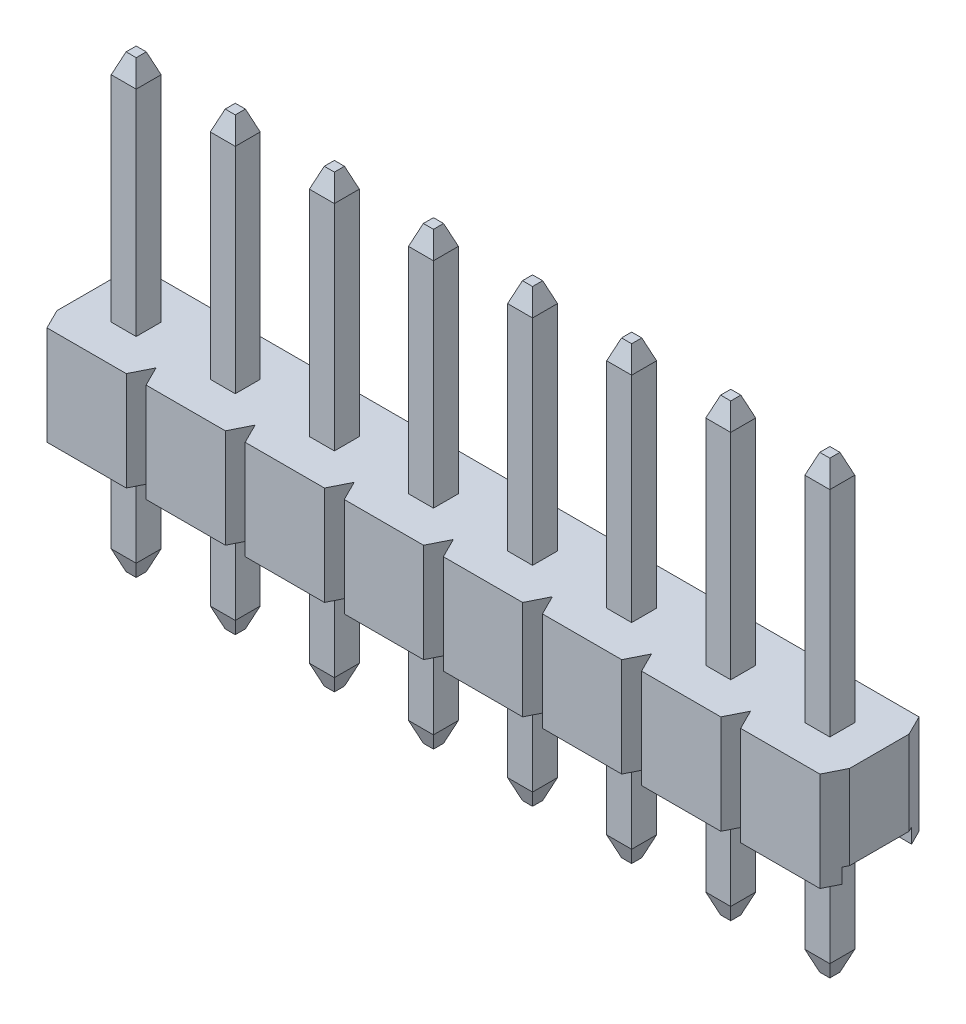
from build123d import *
from OCP.BRepFilletAPI import BRepFilletAPI_MakeChamfer

# Parameters (mm, degrees)
SKETCH1_W                     = 2.54
SKETCH1_H                     = 2.54
MAIN_BODY_DEPTH               = 2.54
SKETCH3_W                     = 1.778
SKETCH3_H                     = 0.381
CUT_EXTRUDE1_DEPTH            = 5.399409051
CUT_EXTRUDE2_DEPTH            = 5.399409051
BODY_PATTERN_COUNT            = 8
BODY_PATTERN_PITCH            = 2.54
PIN_START                     = -5.54
SKETCH2_W                     = 0.64
SKETCH2_H                     = 0.64
PIN_DEPTH                     = 11.54
CHAMFER1_SIZE                 = 0.508
CHAMFER1_SIZE2                = 0.1905
CHAMFER2_SIZE                 = 0.1905
CHAMFER2_SIZE2                = 0.508
PIN_PATTERN_COUNT             = 8
PIN_PATTERN_PITCH             = 2.54
CHAMFER1_OF_PIN_PATTERN_SIZE  = 0.508
CHAMFER1_OF_PIN_PATTERN_SIZE2 = 0.1905
CHAMFER2_OF_PIN_PATTERN_SIZE2 = 0.1905
CHAMFER2_OF_PIN_PATTERN_SIZE  = 0.508


with BuildPart() as part:
    # Sketch1 → Main Body (new body)
    with BuildSketch(Plane(origin=(0, 0, 0), x_dir=(1, 0, 0), z_dir=(0, 1, 0))):
        with Locations((1.27, 1.27)):
            Rectangle(SKETCH1_W, SKETCH1_H)
    main_body = extrude(amount=MAIN_BODY_DEPTH)

    # Sketch3 → Cut-Extrude1 (cut, through all)
    with BuildSketch(Plane.ZY):
        with Locations((-1.27, 0.1905)):
            Rectangle(SKETCH3_W, SKETCH3_H)
    cut_extrude1 = extrude(amount=-CUT_EXTRUDE1_DEPTH, mode=Mode.SUBTRACT)

    # Sketch4 → Cut-Extrude2 (cut, through all)
    with BuildSketch(Plane(origin=(0, 2.54, 0), x_dir=(1, 0, 0), z_dir=(0, 1, 0))):
        Polygon((0.254, 2.54), (0, 2.54), (0, 2.032), align=None)
        Polygon((2.54, 2.54), (2.286, 2.54), (2.54, 2.032), align=None)
        Polygon((0.254, 0), (0, 0.508), (0, 0), align=None)
        Polygon((2.54, 0), (2.286, 0), (2.54, 0.508), align=None)
    cut_extrude2 = extrude(amount=-CUT_EXTRUDE2_DEPTH, mode=Mode.SUBTRACT)

    # Body Pattern: Main Body, Cut-Extrude1, Cut-Extrude2 ×8
    with Locations(*[(-i * BODY_PATTERN_PITCH, 0, 0) for i in range(1, BODY_PATTERN_COUNT)]):
        add(main_body)
        add(cut_extrude1, mode=Mode.SUBTRACT)
        add(cut_extrude2, mode=Mode.SUBTRACT)

    # Sketch2 → Pin (add)
    with BuildSketch(Plane(origin=(0, 2.54, 0), x_dir=(1, 0, 0), z_dir=(0, 1, 0)).offset(PIN_START)):
        with Locations((1.27, 1.27)):
            Rectangle(SKETCH2_W, SKETCH2_H)
    pin = extrude(amount=PIN_DEPTH)

    # Chamfer1: one chamfer whose edges measure the first distance from different faces: ONE call of the kernel's chamfer builder (chamfer() names one face for all edges)
    chamfer1_edges_1 = [part.edges().sort_by_distance(p)[0] for p in [
        (0.95, 8.54, -1.27),
    ]]
    chamfer1_side_1 = [part.faces().sort_by_distance(p)[0] for p in [
        (0.95, 5.54, -1.27),
    ]]
    chamfer1_edges_2 = [part.edges().sort_by_distance(p)[0] for p in [
        (1.27, 8.54, -0.95),
    ]]
    chamfer1_side_2 = [part.faces().sort_by_distance(p)[0] for p in [
        (1.27, 5.54, -0.95),
    ]]
    chamfer1_edges_3 = [part.edges().sort_by_distance(p)[0] for p in [
        (1.59, 8.54, -1.27),
    ]]
    chamfer1_side_3 = [part.faces().sort_by_distance(p)[0] for p in [
        (1.59, 5.54, -1.27),
    ]]
    chamfer1_edges_4 = [part.edges().sort_by_distance(p)[0] for p in [
        (1.27, 8.54, -1.59),
    ]]
    chamfer1_side_4 = [part.faces().sort_by_distance(p)[0] for p in [
        (1.27, 5.54, -1.59),
    ]]
    chamfer1 = BRepFilletAPI_MakeChamfer(part.part.solid().wrapped)
    for e in chamfer1_edges_1:
        chamfer1.Add(CHAMFER1_SIZE, CHAMFER1_SIZE2, e.wrapped, chamfer1_side_1[0].wrapped)  # the first distance lies on this face
    for e in chamfer1_edges_2:
        chamfer1.Add(CHAMFER1_SIZE, CHAMFER1_SIZE2, e.wrapped, chamfer1_side_2[0].wrapped)  # the first distance lies on this face
    for e in chamfer1_edges_3:
        chamfer1.Add(CHAMFER1_SIZE, CHAMFER1_SIZE2, e.wrapped, chamfer1_side_3[0].wrapped)  # the first distance lies on this face
    for e in chamfer1_edges_4:
        chamfer1.Add(CHAMFER1_SIZE, CHAMFER1_SIZE2, e.wrapped, chamfer1_side_4[0].wrapped)  # the first distance lies on this face
    add(Compound.cast(chamfer1.Shape()), mode=Mode.REPLACE)

    # Chamfer2
    chamfer2_edges = [part.edges().sort_by_distance(p)[0] for p in [
        (1.27, -3, -0.95),
        (1.59, -3, -1.27),
        (1.27, -3, -1.59),
        (0.95, -3, -1.27),
    ]]
    chamfer2_side = [part.faces().sort_by_distance(p)[0] for p in [
        (1.27, -3, -1.27),
    ]]
    chamfer(chamfer2_edges, length=CHAMFER2_SIZE, length2=CHAMFER2_SIZE2, reference=chamfer2_side[0])

    # Pin Pattern: Pin ×8
    with Locations(*[(-i * PIN_PATTERN_PITCH, 0, 0) for i in range(1, PIN_PATTERN_COUNT)]):
        add(pin)

    # Chamfer1 of Pin Pattern: one chamfer whose edges measure the first distance from different faces: ONE call of the kernel's chamfer builder (chamfer() names one face for all edges)
    chamfer1_of_pin_pattern_edges_1 = [part.edges().sort_by_distance(p)[0] for p in [
        (-1.59, 8.54, -1.27),
    ]]
    chamfer1_of_pin_pattern_side_1 = [part.faces().sort_by_distance(p)[0] for p in [
        (-1.59, 5.54, -1.27),
    ]]
    chamfer1_of_pin_pattern_edges_2 = [part.edges().sort_by_distance(p)[0] for p in [
        (-1.27, 8.54, -0.95),
    ]]
    chamfer1_of_pin_pattern_side_2 = [part.faces().sort_by_distance(p)[0] for p in [
        (-1.27, 5.54, -0.95),
    ]]
    chamfer1_of_pin_pattern_edges_3 = [part.edges().sort_by_distance(p)[0] for p in [
        (-0.95, 8.54, -1.27),
    ]]
    chamfer1_of_pin_pattern_side_3 = [part.faces().sort_by_distance(p)[0] for p in [
        (-0.95, 5.54, -1.27),
    ]]
    chamfer1_of_pin_pattern_edges_4 = [part.edges().sort_by_distance(p)[0] for p in [
        (-1.27, 8.54, -1.59),
    ]]
    chamfer1_of_pin_pattern_side_4 = [part.faces().sort_by_distance(p)[0] for p in [
        (-1.27, 5.54, -1.59),
    ]]
    chamfer1_of_pin_pattern_edges_5 = [part.edges().sort_by_distance(p)[0] for p in [
        (-4.13, 8.54, -1.27),
    ]]
    chamfer1_of_pin_pattern_side_5 = [part.faces().sort_by_distance(p)[0] for p in [
        (-4.13, 5.54, -1.27),
    ]]
    chamfer1_of_pin_pattern_edges_6 = [part.edges().sort_by_distance(p)[0] for p in [
        (-3.81, 8.54, -0.95),
    ]]
    chamfer1_of_pin_pattern_side_6 = [part.faces().sort_by_distance(p)[0] for p in [
        (-3.81, 5.54, -0.95),
    ]]
    chamfer1_of_pin_pattern_edges_7 = [part.edges().sort_by_distance(p)[0] for p in [
        (-3.49, 8.54, -1.27),
    ]]
    chamfer1_of_pin_pattern_side_7 = [part.faces().sort_by_distance(p)[0] for p in [
        (-3.49, 5.54, -1.27),
    ]]
    chamfer1_of_pin_pattern_edges_8 = [part.edges().sort_by_distance(p)[0] for p in [
        (-3.81, 8.54, -1.59),
    ]]
    chamfer1_of_pin_pattern_side_8 = [part.faces().sort_by_distance(p)[0] for p in [
        (-3.81, 5.54, -1.59),
    ]]
    chamfer1_of_pin_pattern_edges_9 = [part.edges().sort_by_distance(p)[0] for p in [
        (-6.67, 8.54, -1.27),
    ]]
    chamfer1_of_pin_pattern_side_9 = [part.faces().sort_by_distance(p)[0] for p in [
        (-6.67, 5.54, -1.27),
    ]]
    chamfer1_of_pin_pattern_edges_10 = [part.edges().sort_by_distance(p)[0] for p in [
        (-6.35, 8.54, -0.95),
    ]]
    chamfer1_of_pin_pattern_side_10 = [part.faces().sort_by_distance(p)[0] for p in [
        (-6.35, 5.54, -0.95),
    ]]
    chamfer1_of_pin_pattern_edges_11 = [part.edges().sort_by_distance(p)[0] for p in [
        (-6.03, 8.54, -1.27),
    ]]
    chamfer1_of_pin_pattern_side_11 = [part.faces().sort_by_distance(p)[0] for p in [
        (-6.03, 5.54, -1.27),
    ]]
    chamfer1_of_pin_pattern_edges_12 = [part.edges().sort_by_distance(p)[0] for p in [
        (-6.35, 8.54, -1.59),
    ]]
    chamfer1_of_pin_pattern_side_12 = [part.faces().sort_by_distance(p)[0] for p in [
        (-6.35, 5.54, -1.59),
    ]]
    chamfer1_of_pin_pattern_edges_13 = [part.edges().sort_by_distance(p)[0] for p in [
        (-9.21, 8.54, -1.27),
    ]]
    chamfer1_of_pin_pattern_side_13 = [part.faces().sort_by_distance(p)[0] for p in [
        (-9.21, 5.54, -1.27),
    ]]
    chamfer1_of_pin_pattern_edges_14 = [part.edges().sort_by_distance(p)[0] for p in [
        (-8.89, 8.54, -0.95),
    ]]
    chamfer1_of_pin_pattern_side_14 = [part.faces().sort_by_distance(p)[0] for p in [
        (-8.89, 5.54, -0.95),
    ]]
    chamfer1_of_pin_pattern_edges_15 = [part.edges().sort_by_distance(p)[0] for p in [
        (-8.57, 8.54, -1.27),
    ]]
    chamfer1_of_pin_pattern_side_15 = [part.faces().sort_by_distance(p)[0] for p in [
        (-8.57, 5.54, -1.27),
    ]]
    chamfer1_of_pin_pattern_edges_16 = [part.edges().sort_by_distance(p)[0] for p in [
        (-8.89, 8.54, -1.59),
    ]]
    chamfer1_of_pin_pattern_side_16 = [part.faces().sort_by_distance(p)[0] for p in [
        (-8.89, 5.54, -1.59),
    ]]
    chamfer1_of_pin_pattern_edges_17 = [part.edges().sort_by_distance(p)[0] for p in [
        (-11.75, 8.54, -1.27),
    ]]
    chamfer1_of_pin_pattern_side_17 = [part.faces().sort_by_distance(p)[0] for p in [
        (-11.75, 5.54, -1.27),
    ]]
    chamfer1_of_pin_pattern_edges_18 = [part.edges().sort_by_distance(p)[0] for p in [
        (-11.43, 8.54, -0.95),
    ]]
    chamfer1_of_pin_pattern_side_18 = [part.faces().sort_by_distance(p)[0] for p in [
        (-11.43, 5.54, -0.95),
    ]]
    chamfer1_of_pin_pattern_edges_19 = [part.edges().sort_by_distance(p)[0] for p in [
        (-11.11, 8.54, -1.27),
    ]]
    chamfer1_of_pin_pattern_side_19 = [part.faces().sort_by_distance(p)[0] for p in [
        (-11.11, 5.54, -1.27),
    ]]
    chamfer1_of_pin_pattern_edges_20 = [part.edges().sort_by_distance(p)[0] for p in [
        (-11.43, 8.54, -1.59),
    ]]
    chamfer1_of_pin_pattern_side_20 = [part.faces().sort_by_distance(p)[0] for p in [
        (-11.43, 5.54, -1.59),
    ]]
    chamfer1_of_pin_pattern_edges_21 = [part.edges().sort_by_distance(p)[0] for p in [
        (-14.29, 8.54, -1.27),
    ]]
    chamfer1_of_pin_pattern_side_21 = [part.faces().sort_by_distance(p)[0] for p in [
        (-14.29, 5.54, -1.27),
    ]]
    chamfer1_of_pin_pattern_edges_22 = [part.edges().sort_by_distance(p)[0] for p in [
        (-13.97, 8.54, -0.95),
    ]]
    chamfer1_of_pin_pattern_side_22 = [part.faces().sort_by_distance(p)[0] for p in [
        (-13.97, 5.54, -0.95),
    ]]
    chamfer1_of_pin_pattern_edges_23 = [part.edges().sort_by_distance(p)[0] for p in [
        (-13.65, 8.54, -1.27),
    ]]
    chamfer1_of_pin_pattern_side_23 = [part.faces().sort_by_distance(p)[0] for p in [
        (-13.65, 5.54, -1.27),
    ]]
    chamfer1_of_pin_pattern_edges_24 = [part.edges().sort_by_distance(p)[0] for p in [
        (-13.97, 8.54, -1.59),
    ]]
    chamfer1_of_pin_pattern_side_24 = [part.faces().sort_by_distance(p)[0] for p in [
        (-13.97, 5.54, -1.59),
    ]]
    chamfer1_of_pin_pattern_edges_25 = [part.edges().sort_by_distance(p)[0] for p in [
        (-16.83, 8.54, -1.27),
    ]]
    chamfer1_of_pin_pattern_side_25 = [part.faces().sort_by_distance(p)[0] for p in [
        (-16.83, 5.54, -1.27),
    ]]
    chamfer1_of_pin_pattern_edges_26 = [part.edges().sort_by_distance(p)[0] for p in [
        (-16.51, 8.54, -0.95),
    ]]
    chamfer1_of_pin_pattern_side_26 = [part.faces().sort_by_distance(p)[0] for p in [
        (-16.51, 5.54, -0.95),
    ]]
    chamfer1_of_pin_pattern_edges_27 = [part.edges().sort_by_distance(p)[0] for p in [
        (-16.19, 8.54, -1.27),
    ]]
    chamfer1_of_pin_pattern_side_27 = [part.faces().sort_by_distance(p)[0] for p in [
        (-16.19, 5.54, -1.27),
    ]]
    chamfer1_of_pin_pattern_edges_28 = [part.edges().sort_by_distance(p)[0] for p in [
        (-16.51, 8.54, -1.59),
    ]]
    chamfer1_of_pin_pattern_side_28 = [part.faces().sort_by_distance(p)[0] for p in [
        (-16.51, 5.54, -1.59),
    ]]
    chamfer1_of_pin_pattern = BRepFilletAPI_MakeChamfer(part.part.solid().wrapped)
    for e in chamfer1_of_pin_pattern_edges_1:
        chamfer1_of_pin_pattern.Add(CHAMFER1_OF_PIN_PATTERN_SIZE, CHAMFER1_OF_PIN_PATTERN_SIZE2, e.wrapped, chamfer1_of_pin_pattern_side_1[0].wrapped)  # the first distance lies on this face
    for e in chamfer1_of_pin_pattern_edges_2:
        chamfer1_of_pin_pattern.Add(CHAMFER1_OF_PIN_PATTERN_SIZE, CHAMFER1_OF_PIN_PATTERN_SIZE2, e.wrapped, chamfer1_of_pin_pattern_side_2[0].wrapped)  # the first distance lies on this face
    for e in chamfer1_of_pin_pattern_edges_3:
        chamfer1_of_pin_pattern.Add(CHAMFER1_OF_PIN_PATTERN_SIZE, CHAMFER1_OF_PIN_PATTERN_SIZE2, e.wrapped, chamfer1_of_pin_pattern_side_3[0].wrapped)  # the first distance lies on this face
    for e in chamfer1_of_pin_pattern_edges_4:
        chamfer1_of_pin_pattern.Add(CHAMFER1_OF_PIN_PATTERN_SIZE, CHAMFER1_OF_PIN_PATTERN_SIZE2, e.wrapped, chamfer1_of_pin_pattern_side_4[0].wrapped)  # the first distance lies on this face
    for e in chamfer1_of_pin_pattern_edges_5:
        chamfer1_of_pin_pattern.Add(CHAMFER1_OF_PIN_PATTERN_SIZE, CHAMFER1_OF_PIN_PATTERN_SIZE2, e.wrapped, chamfer1_of_pin_pattern_side_5[0].wrapped)  # the first distance lies on this face
    for e in chamfer1_of_pin_pattern_edges_6:
        chamfer1_of_pin_pattern.Add(CHAMFER1_OF_PIN_PATTERN_SIZE, CHAMFER1_OF_PIN_PATTERN_SIZE2, e.wrapped, chamfer1_of_pin_pattern_side_6[0].wrapped)  # the first distance lies on this face
    for e in chamfer1_of_pin_pattern_edges_7:
        chamfer1_of_pin_pattern.Add(CHAMFER1_OF_PIN_PATTERN_SIZE, CHAMFER1_OF_PIN_PATTERN_SIZE2, e.wrapped, chamfer1_of_pin_pattern_side_7[0].wrapped)  # the first distance lies on this face
    for e in chamfer1_of_pin_pattern_edges_8:
        chamfer1_of_pin_pattern.Add(CHAMFER1_OF_PIN_PATTERN_SIZE, CHAMFER1_OF_PIN_PATTERN_SIZE2, e.wrapped, chamfer1_of_pin_pattern_side_8[0].wrapped)  # the first distance lies on this face
    for e in chamfer1_of_pin_pattern_edges_9:
        chamfer1_of_pin_pattern.Add(CHAMFER1_OF_PIN_PATTERN_SIZE, CHAMFER1_OF_PIN_PATTERN_SIZE2, e.wrapped, chamfer1_of_pin_pattern_side_9[0].wrapped)  # the first distance lies on this face
    for e in chamfer1_of_pin_pattern_edges_10:
        chamfer1_of_pin_pattern.Add(CHAMFER1_OF_PIN_PATTERN_SIZE, CHAMFER1_OF_PIN_PATTERN_SIZE2, e.wrapped, chamfer1_of_pin_pattern_side_10[0].wrapped)  # the first distance lies on this face
    for e in chamfer1_of_pin_pattern_edges_11:
        chamfer1_of_pin_pattern.Add(CHAMFER1_OF_PIN_PATTERN_SIZE, CHAMFER1_OF_PIN_PATTERN_SIZE2, e.wrapped, chamfer1_of_pin_pattern_side_11[0].wrapped)  # the first distance lies on this face
    for e in chamfer1_of_pin_pattern_edges_12:
        chamfer1_of_pin_pattern.Add(CHAMFER1_OF_PIN_PATTERN_SIZE, CHAMFER1_OF_PIN_PATTERN_SIZE2, e.wrapped, chamfer1_of_pin_pattern_side_12[0].wrapped)  # the first distance lies on this face
    for e in chamfer1_of_pin_pattern_edges_13:
        chamfer1_of_pin_pattern.Add(CHAMFER1_OF_PIN_PATTERN_SIZE, CHAMFER1_OF_PIN_PATTERN_SIZE2, e.wrapped, chamfer1_of_pin_pattern_side_13[0].wrapped)  # the first distance lies on this face
    for e in chamfer1_of_pin_pattern_edges_14:
        chamfer1_of_pin_pattern.Add(CHAMFER1_OF_PIN_PATTERN_SIZE, CHAMFER1_OF_PIN_PATTERN_SIZE2, e.wrapped, chamfer1_of_pin_pattern_side_14[0].wrapped)  # the first distance lies on this face
    for e in chamfer1_of_pin_pattern_edges_15:
        chamfer1_of_pin_pattern.Add(CHAMFER1_OF_PIN_PATTERN_SIZE, CHAMFER1_OF_PIN_PATTERN_SIZE2, e.wrapped, chamfer1_of_pin_pattern_side_15[0].wrapped)  # the first distance lies on this face
    for e in chamfer1_of_pin_pattern_edges_16:
        chamfer1_of_pin_pattern.Add(CHAMFER1_OF_PIN_PATTERN_SIZE, CHAMFER1_OF_PIN_PATTERN_SIZE2, e.wrapped, chamfer1_of_pin_pattern_side_16[0].wrapped)  # the first distance lies on this face
    for e in chamfer1_of_pin_pattern_edges_17:
        chamfer1_of_pin_pattern.Add(CHAMFER1_OF_PIN_PATTERN_SIZE, CHAMFER1_OF_PIN_PATTERN_SIZE2, e.wrapped, chamfer1_of_pin_pattern_side_17[0].wrapped)  # the first distance lies on this face
    for e in chamfer1_of_pin_pattern_edges_18:
        chamfer1_of_pin_pattern.Add(CHAMFER1_OF_PIN_PATTERN_SIZE, CHAMFER1_OF_PIN_PATTERN_SIZE2, e.wrapped, chamfer1_of_pin_pattern_side_18[0].wrapped)  # the first distance lies on this face
    for e in chamfer1_of_pin_pattern_edges_19:
        chamfer1_of_pin_pattern.Add(CHAMFER1_OF_PIN_PATTERN_SIZE, CHAMFER1_OF_PIN_PATTERN_SIZE2, e.wrapped, chamfer1_of_pin_pattern_side_19[0].wrapped)  # the first distance lies on this face
    for e in chamfer1_of_pin_pattern_edges_20:
        chamfer1_of_pin_pattern.Add(CHAMFER1_OF_PIN_PATTERN_SIZE, CHAMFER1_OF_PIN_PATTERN_SIZE2, e.wrapped, chamfer1_of_pin_pattern_side_20[0].wrapped)  # the first distance lies on this face
    for e in chamfer1_of_pin_pattern_edges_21:
        chamfer1_of_pin_pattern.Add(CHAMFER1_OF_PIN_PATTERN_SIZE, CHAMFER1_OF_PIN_PATTERN_SIZE2, e.wrapped, chamfer1_of_pin_pattern_side_21[0].wrapped)  # the first distance lies on this face
    for e in chamfer1_of_pin_pattern_edges_22:
        chamfer1_of_pin_pattern.Add(CHAMFER1_OF_PIN_PATTERN_SIZE, CHAMFER1_OF_PIN_PATTERN_SIZE2, e.wrapped, chamfer1_of_pin_pattern_side_22[0].wrapped)  # the first distance lies on this face
    for e in chamfer1_of_pin_pattern_edges_23:
        chamfer1_of_pin_pattern.Add(CHAMFER1_OF_PIN_PATTERN_SIZE, CHAMFER1_OF_PIN_PATTERN_SIZE2, e.wrapped, chamfer1_of_pin_pattern_side_23[0].wrapped)  # the first distance lies on this face
    for e in chamfer1_of_pin_pattern_edges_24:
        chamfer1_of_pin_pattern.Add(CHAMFER1_OF_PIN_PATTERN_SIZE, CHAMFER1_OF_PIN_PATTERN_SIZE2, e.wrapped, chamfer1_of_pin_pattern_side_24[0].wrapped)  # the first distance lies on this face
    for e in chamfer1_of_pin_pattern_edges_25:
        chamfer1_of_pin_pattern.Add(CHAMFER1_OF_PIN_PATTERN_SIZE, CHAMFER1_OF_PIN_PATTERN_SIZE2, e.wrapped, chamfer1_of_pin_pattern_side_25[0].wrapped)  # the first distance lies on this face
    for e in chamfer1_of_pin_pattern_edges_26:
        chamfer1_of_pin_pattern.Add(CHAMFER1_OF_PIN_PATTERN_SIZE, CHAMFER1_OF_PIN_PATTERN_SIZE2, e.wrapped, chamfer1_of_pin_pattern_side_26[0].wrapped)  # the first distance lies on this face
    for e in chamfer1_of_pin_pattern_edges_27:
        chamfer1_of_pin_pattern.Add(CHAMFER1_OF_PIN_PATTERN_SIZE, CHAMFER1_OF_PIN_PATTERN_SIZE2, e.wrapped, chamfer1_of_pin_pattern_side_27[0].wrapped)  # the first distance lies on this face
    for e in chamfer1_of_pin_pattern_edges_28:
        chamfer1_of_pin_pattern.Add(CHAMFER1_OF_PIN_PATTERN_SIZE, CHAMFER1_OF_PIN_PATTERN_SIZE2, e.wrapped, chamfer1_of_pin_pattern_side_28[0].wrapped)  # the first distance lies on this face
    add(Compound.cast(chamfer1_of_pin_pattern.Shape()), mode=Mode.REPLACE)

    # Chamfer2 of Pin Pattern
    chamfer2_of_pin_pattern_edges = [part.edges().sort_by_distance(p)[0] for p in [
        (-1.27, -3, -0.95),
        (-0.95, -3, -1.27),
        (-1.27, -3, -1.59),
        (-1.59, -3, -1.27),
        (-3.81, -3, -0.95),
        (-3.49, -3, -1.27),
        (-3.81, -3, -1.59),
        (-4.13, -3, -1.27),
        (-6.35, -3, -0.95),
        (-6.03, -3, -1.27),
        (-6.35, -3, -1.59),
        (-6.67, -3, -1.27),
        (-8.89, -3, -0.95),
        (-8.57, -3, -1.27),
        (-8.89, -3, -1.59),
        (-9.21, -3, -1.27),
        (-11.43, -3, -0.95),
        (-11.11, -3, -1.27),
        (-11.43, -3, -1.59),
        (-11.75, -3, -1.27),
        (-13.97, -3, -0.95),
        (-13.65, -3, -1.27),
        (-13.97, -3, -1.59),
        (-14.29, -3, -1.27),
        (-16.51, -3, -0.95),
        (-16.19, -3, -1.27),
        (-16.51, -3, -1.59),
        (-16.83, -3, -1.27),
    ]]
    chamfer(chamfer2_of_pin_pattern_edges, length=CHAMFER2_OF_PIN_PATTERN_SIZE, length2=CHAMFER2_OF_PIN_PATTERN_SIZE2)


solid = part.part
